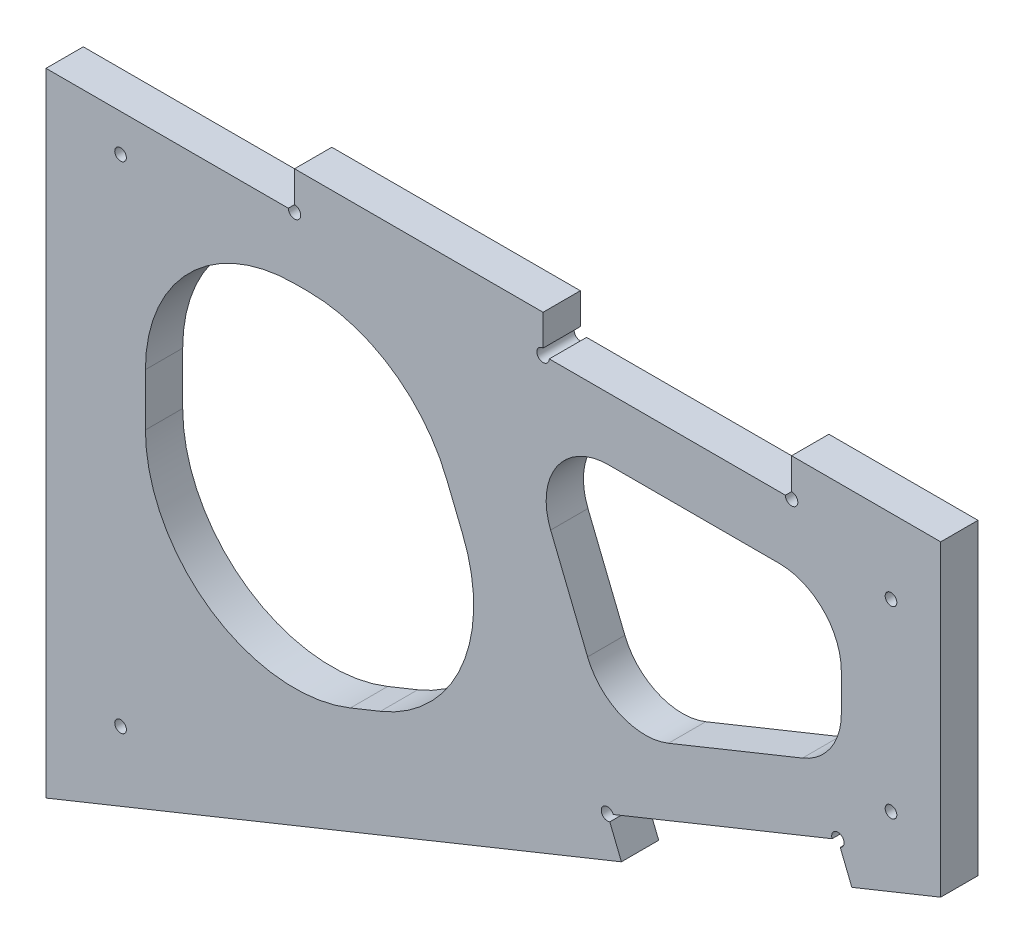
from build123d import *

# Parameters (mm, degrees)
BOSS_EXTRUDE1_DEPTH              = 19.05
CUT_EXTRUDE2_DEPTH               = 7658.473916494
FILLET1_R                        = 76.2
FILLET2_R                        = 31.75
SKETCH2_W                        = 127
SKETCH2_H                        = 19.05
CUT_EXTRUDE1_DEPTH               = 7658.473916494
F_1_4_0_25_DIAMETER_HOLE1_D      = 6.35
F_15_64_0_23438_DIAMETER_HOLE1_D = 5.953252


with BuildPart() as part:
    # Sketch1 → Boss-Extrude1 (new body)
    with BuildSketch(Plane.XY):
        Polygon((3140.71, 6983.72999014), (2683.51, 6983.72999014), (2683.51, 6641.741886848), (3140.71, 6826.4626773), align=None)
    extrude(amount=BOSS_EXTRUDE1_DEPTH)

    # Sketch6 → Cut-Extrude2 (cut, through all)
    with BuildSketch(Plane(origin=(0, 0, 0), x_dir=(-1, 0, 0), z_dir=(0, 0, -1))):
        Polygon((-2923.76447292, 6932.92999014), (-3089.91, 6932.92999014), (-3089.91, 6860.727709955), (-2972.15765047, 6813.152672592), align=None)
        Polygon((-2925.056710658, 6794.122657646), (-2734.31, 6717.055984048), (-2734.31, 6932.92999014), (-2868.974907992, 6932.92999014), align=None)
    extrude(amount=-CUT_EXTRUDE2_DEPTH, mode=Mode.SUBTRACT)

    # Fillet1
    fillet1_edges = [part.edges().sort_by_distance(p)[0] for p in [
        (2925.056710658, 6794.122657646, 9.525),
        (2868.974907992, 6932.92999014, 9.525),
        (2734.31, 6932.92999014, 9.525),
        (2734.31, 6717.055984048, 9.525),
    ]]
    fillet(fillet1_edges, radius=FILLET1_R)

    # Fillet2
    fillet2_edges = [part.edges().sort_by_distance(p)[0] for p in [
        (2972.15765047, 6813.152672592, 9.525),
        (3089.91, 6860.727709955, 9.525),
        (3089.91, 6932.92999014, 9.525),
        (2923.76447292, 6932.92999014, 9.525),
    ]]
    fillet(fillet2_edges, radius=FILLET2_R)

    # Sketch2 → Cut-Extrude1 (cut, through all)
    with BuildSketch(Plane(origin=(0, 0, 0), x_dir=(-1, 0, 0), z_dir=(0, 0, -1))):
        with Locations((-2747.01, 6974.20499014)):
            Rectangle(SKETCH2_W, SKETCH2_H)
        with Locations((-3001.01, 6974.20499014)):
            Rectangle(SKETCH2_W, SKETCH2_H)
        Polygon((-2977.551881268, 6760.542518374), (-3095.304230798, 6808.117555738), (-3088.167975193, 6825.780408168), (-2970.415625663, 6778.205370804), align=None)
    extrude(amount=-CUT_EXTRUDE1_DEPTH, mode=Mode.SUBTRACT)

    # 1/4 (0.25) Diameter Hole1 (through all)
    with Locations(Plane(origin=(0, 0, 0), x_dir=(-1, 0, 0), z_dir=(0, 0, -1))):
        with Locations((-3088.167975193, 6825.780408168), (-2970.415625663, 6778.205370804), (-2937.51, 6964.67999014), (-3064.51, 6964.67999014), (-2810.51, 6964.67999014)):
            Hole(F_1_4_0_25_DIAMETER_HOLE1_D / 2)

    # 15/64 (0.23438) Diameter Hole1 (through all)
    with Locations(Plane.YX):
        with Locations((6692.541891629, 2721.610000001), (6945.629994921, 2721.610000001), (6945.629994921, 3115.310000001), (6851.60701674, 3115.310000001)):
            Hole(F_15_64_0_23438_DIAMETER_HOLE1_D / 2)


solid = part.part
